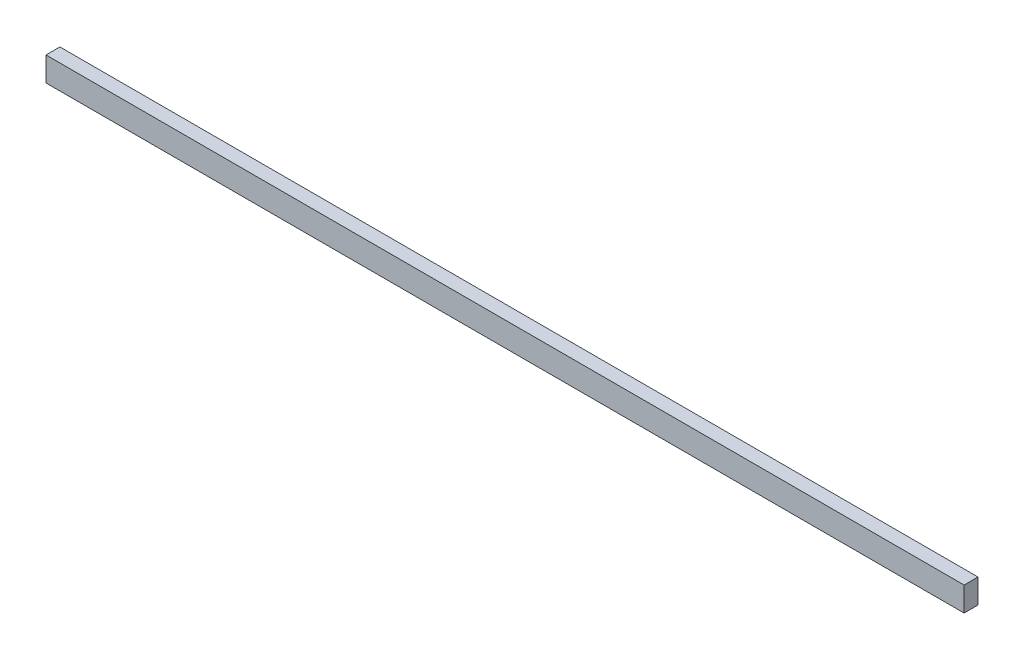
from build123d import *

# Parameters (mm, degrees)
SKETCH1_W           = 529
SKETCH1_H           = 14
BOSS_EXTRUDE1_DEPTH = 8
SKETCH2_R           = 2
CUT_EXTRUDE1_DEPTH  = 10


with BuildPart() as part:
    # Sketch1 → Boss-Extrude1 (new body)
    with BuildSketch(Plane.XY):
        with Locations((11.794617564, -29.40368272)):
            Rectangle(SKETCH1_W, SKETCH1_H)
    extrude(amount=BOSS_EXTRUDE1_DEPTH)

    # Sketch2 → Cut-Extrude1 (cut)
    with BuildSketch(Plane.XZ.offset(36.40368272)):
        with Locations(Location((-236.705382436, 4, 0), (0, 0, 270))):
            Circle(SKETCH2_R)
        with Locations(Location((260.294617564, 4, 0), (0, 0, 270))):
            Circle(SKETCH2_R)
    extrude(amount=-CUT_EXTRUDE1_DEPTH, mode=Mode.SUBTRACT)


solid = part.part
